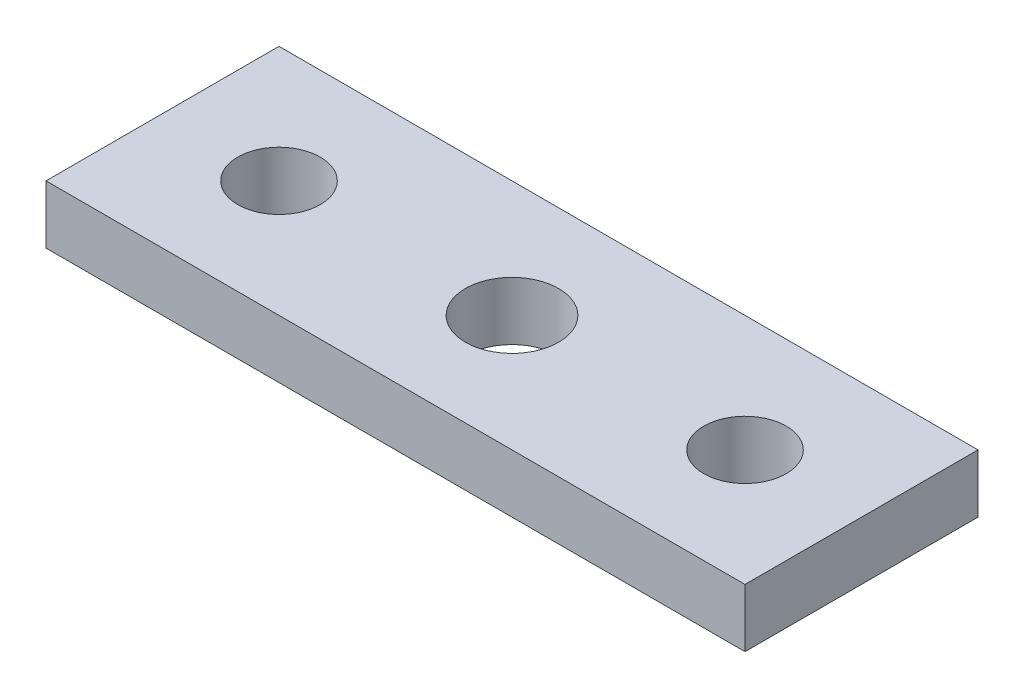
from build123d import *

# Parameters (mm, degrees)
SKETCH1_W             = 38.1
SKETCH1_H             = 12.7
BOSS_EXTRUDE1_DEPTH   = 3.175
SKETCH2_R             = 2.54
CUT_EXTRUDE1_DEPTH    = 21.329919454
F_8_CLEARANCE_HOLE1_D = 4.4958


with BuildPart() as part:
    # Sketch1 → Boss-Extrude1 (new body)
    with BuildSketch(Plane(origin=(0, 0, 0), x_dir=(1, 0, 0), z_dir=(0, 1, 0))):
        Rectangle(SKETCH1_W, SKETCH1_H)
    extrude(amount=BOSS_EXTRUDE1_DEPTH)

    # Sketch2 → Cut-Extrude1 (cut, through all)
    with BuildSketch(Plane(origin=(0, 3.175, 0), x_dir=(1, 0, 0), z_dir=(0, 1, 0))):
        with Locations(Location((0, 0, 0), (0, 0, 270))):
            Circle(SKETCH2_R)
    extrude(amount=-CUT_EXTRUDE1_DEPTH, mode=Mode.SUBTRACT)

    # #8 Clearance Hole1 (through all)
    with Locations(Plane(origin=(0, 3.175, 0), x_dir=(1, 0, 0), z_dir=(0, 1, 0))):
        with Locations((-12.7, 0), (12.7, 0)):
            Hole(F_8_CLEARANCE_HOLE1_D / 2)


solid = part.part
